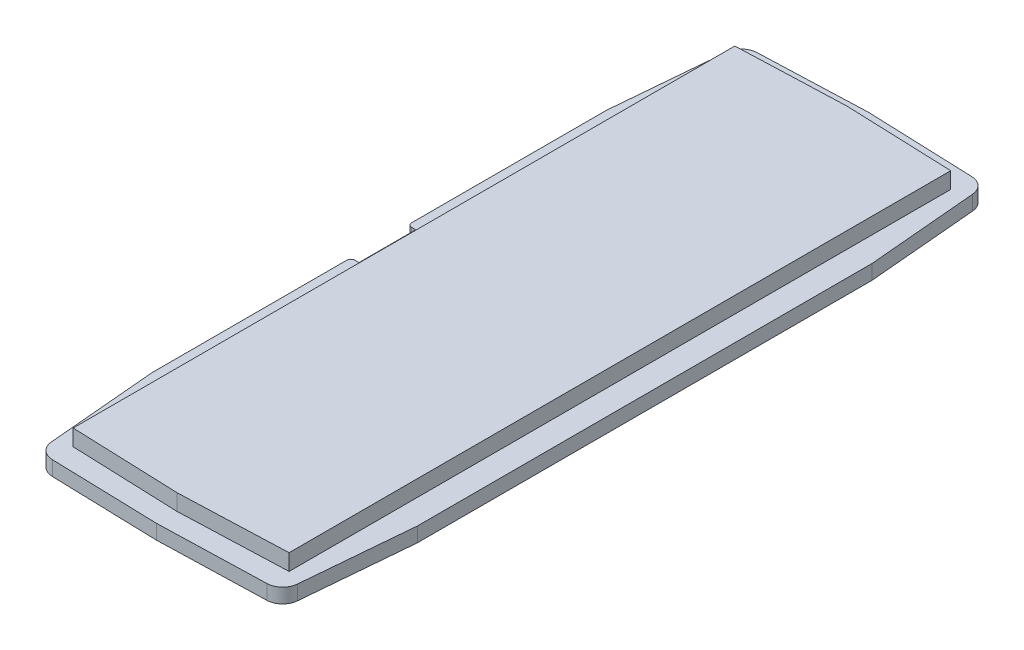
from build123d import *

# Parameters (mm, degrees)
EXTRUDE_1_DEPTH = 1.8
EXTRUDE_2_DEPTH = 3.8
FILLET_1_R      = 2


with BuildPart() as part:
    # Эскиз1 → Бобышка-Вытянуть1 (new body)
    with BuildSketch(Plane(origin=(0, 0, 0), x_dir=(1, 0, 0), z_dir=(0, 1, 0))):
        with BuildLine():
            Line((-15, 43.349382745), (-16.35, 28))
            Line((-16.35, 28), (-16.35, 4))
            ThreePointArc((-16.35, 4), (-16.203553391, 3.646446609), (-15.85, 3.5))
            Line((-15.85, 3.5), (-15.35, 3.5))
            Line((-15.35, 3.5), (-15.35, -3.5))
            Line((-15.35, -3.5), (-15.85, -3.5))
            ThreePointArc((-15.85, -3.5), (-16.203553391, -3.646446609), (-16.35, -4))
            Line((-16.35, -4), (-16.35, -28))
            Line((-16.35, -28), (-15, -43.35061617))
            Line((-15, -43.35061617), (0, -43.784698928))
            Line((0, -43.784698928), (15, -43.35061617))
            Line((15, -43.35061617), (16.35, -28))
            Line((16.35, -28), (16.35, 28))
            Line((16.35, 28), (15, 43.349382745))
            Line((15, 43.349382745), (0, 43.915301072))
            Line((0, 43.915301072), (-15, 43.349382745))
        make_face()
    extrude(amount=EXTRUDE_1_DEPTH)

    # Эскиз4 → Бобышка-Вытянуть2 (add)
    with BuildSketch(Plane(origin=(0, 0, 0), x_dir=(1, 0, 0), z_dir=(0, 1, 0))):
        Polygon((-13.3, 40.75), (-13.3, -40.75), (0, -41.25), (13.3, -40.75), (13.3, 40.75), (0, 41.25), align=None)
    extrude(amount=EXTRUDE_2_DEPTH)

    # Скругление1
    fillet_1_edges = [part.edges().sort_by_distance(p)[0] for p in [
        (-15, 0.9, -43.349382745),
        (15, 0.9, -43.349382745),
        (15, 0.9, 43.35061617),
        (-15, 0.9, 43.35061617),
    ]]
    fillet(fillet_1_edges, radius=FILLET_1_R)


solid = part.part
